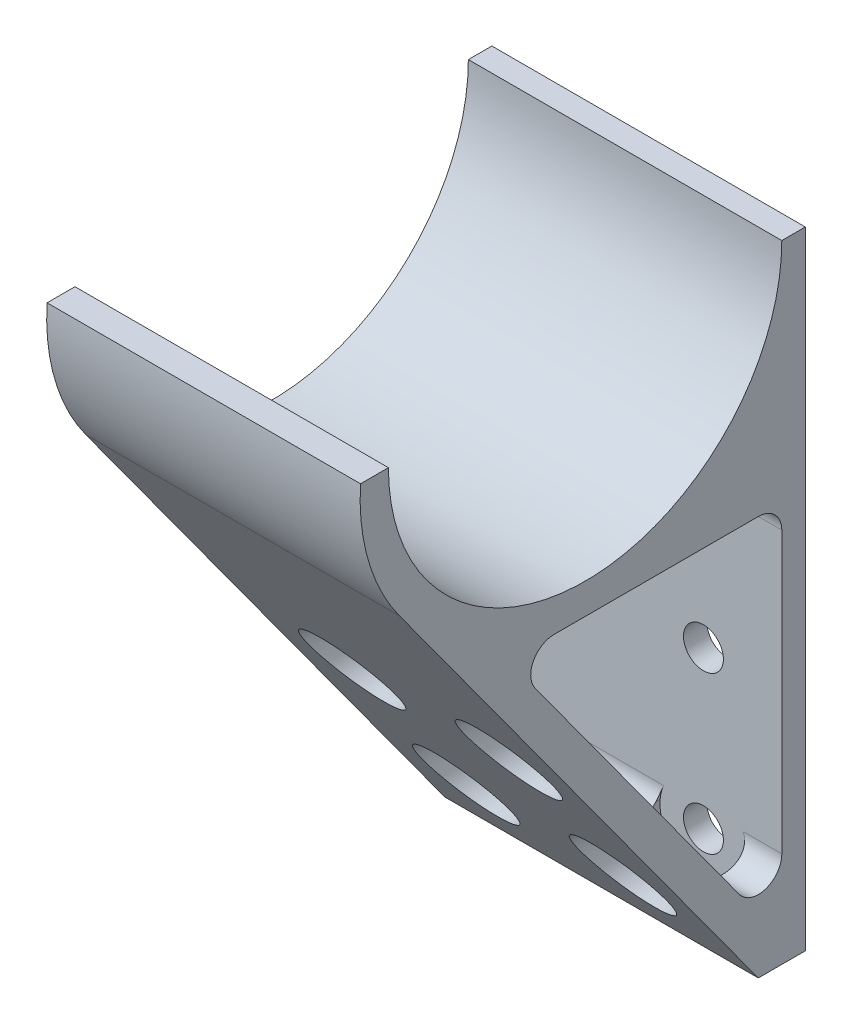
from build123d import *

# Parameters (mm, degrees)
EXTRUDE_1_DEPTH     = 40
SKETCH_2_R          = 2.55
CUT_EXTRUDE_1_DEPTH = 106.960776396
CUT_EXTRUDE_2_REACH = 106.383
SKETCH_3_R          = 5.55
SKETCH_3_R_2        = 2.55


with BuildPart() as part:
    # Эскиз1 → Бобышка-Вытянуть1 (new body)
    with BuildSketch(Plane(origin=(0, 0, 0), x_dir=(0, 0, -1), z_dir=(1, 0, 0))):
        with BuildLine():
            Line((0, 0), (0, -80))
            Line((0, -80), (-6, -80))
            Line((-6, -80), (-51.793990257, -17.080263038))
            ThreePointArc((-51.793990257, -17.080263038), (-55.770359862, -8.97429964), (-56.760361788, 0))
            Line((-56.760361788, 0), (-53.2, 0))
            ThreePointArc((-53.2, 0), (-28.1, -25.1), (-3, 0))
            Line((-3, 0), (0, 0))
        make_face()
        with BuildLine():
            Line((-3, -32), (-3, -67.780017305))
            ThreePointArc((-3, -67.780017305), (-5.071760776, -70.632800498), (-8.425581296, -69.545394143))
            Line((-8.425581296, -69.545394143), (-34.466849791, -33.765376837))
            ThreePointArc((-34.466849791, -33.765376837), (-34.714855086, -30.639141909), (-32.041268495, -29))
            Line((-32.041268495, -29), (-6, -29))
            ThreePointArc((-6, -29), (-3.878679656, -29.878679656), (-3, -32))
        make_face(mode=Mode.SUBTRACT)
    extrude(amount=EXTRUDE_1_DEPTH)

    # Эскиз2 → Вырез-Вытянуть1 (cut, through all)
    with BuildSketch(Plane(origin=(0, 0, 0), x_dir=(-1, 0, 0), z_dir=(0, 0, -1))):
        with Locations(Location((-30, -50, 0), (0, 0, 270))):
            Circle(SKETCH_2_R)
        with Locations(Location((-10, -50, 0), (0, 0, 270))):
            Circle(SKETCH_2_R)
        with Locations((-10, -70)):
            Circle(SKETCH_2_R)
        with Locations((-30, -70)):
            Circle(SKETCH_2_R)
    extrude(amount=-CUT_EXTRUDE_1_DEPTH, mode=Mode.SUBTRACT)

    # Вырез-Вытянуть2: up to this plane
    cut_extrude_2_end = Plane(origin=(40, -80, 6), z_dir=(0, 0.5884589457091373, -0.8085270986274306))
    # Эскиз3 → Вырез-Вытянуть2 (cut, up to the surface)
    with BuildSketch(Plane.XY.offset(3), mode=Mode.PRIVATE) as cut_extrude_2_sk1:
        with Locations(Location((10, -50, 0), (0, 0, 270))):
            Circle(SKETCH_3_R)
        with Locations(Location((10, -50, 0), (0, 0, 180))):
            Circle(SKETCH_3_R_2, mode=Mode.SUBTRACT)
    cut_extrude_2_tool1 = split(extrude(cut_extrude_2_sk1.sketch, amount=CUT_EXTRUDE_2_REACH, mode=Mode.PRIVATE), bisect_by=cut_extrude_2_end, keep=Keep.BOTH, mode=Mode.PRIVATE)
    add(cut_extrude_2_tool1.solids().sort_by_distance((10, -44.606978, 3))[0], mode=Mode.SUBTRACT)
    # Эскиз3 → Вырез-Вытянуть2 (cut, up to the surface)
    with BuildSketch(Plane.XY.offset(3), mode=Mode.PRIVATE) as cut_extrude_2_sk2:
        with Locations(Location((30, -50, 0), (0, 0, 270))):
            Circle(SKETCH_3_R)
        with Locations(Location((30, -50, 0), (0, 0, 180))):
            Circle(SKETCH_3_R_2, mode=Mode.SUBTRACT)
    cut_extrude_2_tool2 = split(extrude(cut_extrude_2_sk2.sketch, amount=CUT_EXTRUDE_2_REACH, mode=Mode.PRIVATE), bisect_by=cut_extrude_2_end, keep=Keep.BOTH, mode=Mode.PRIVATE)
    add(cut_extrude_2_tool2.solids().sort_by_distance((30, -44.606978, 3))[0], mode=Mode.SUBTRACT)
    # Эскиз3 → Вырез-Вытянуть2 (cut, up to the surface)
    with BuildSketch(Plane.XY.offset(3), mode=Mode.PRIVATE) as cut_extrude_2_sk3:
        with Locations(Location((10, -70, 0), (0, 0, 175.301583439))):
            Circle(SKETCH_3_R)
        with Locations(Location((10, -70, 0), (0, 0, 180))):
            Circle(SKETCH_3_R_2, mode=Mode.SUBTRACT)
    cut_extrude_2_tool3 = split(extrude(cut_extrude_2_sk3.sketch, amount=CUT_EXTRUDE_2_REACH, mode=Mode.PRIVATE), bisect_by=cut_extrude_2_end, keep=Keep.BOTH, mode=Mode.PRIVATE)
    add(cut_extrude_2_tool3.solids().sort_by_distance((15.3749, -70.441748, 3))[0], mode=Mode.SUBTRACT)
    # Эскиз3 → Вырез-Вытянуть2 (cut, up to the surface)
    with BuildSketch(Plane.XY.offset(3), mode=Mode.PRIVATE) as cut_extrude_2_sk4:
        with Locations(Location((30, -70, 0), (0, 0, 175.301583439))):
            Circle(SKETCH_3_R)
        with Locations(Location((30, -70, 0), (0, 0, 180))):
            Circle(SKETCH_3_R_2, mode=Mode.SUBTRACT)
    cut_extrude_2_tool4 = split(extrude(cut_extrude_2_sk4.sketch, amount=CUT_EXTRUDE_2_REACH, mode=Mode.PRIVATE), bisect_by=cut_extrude_2_end, keep=Keep.BOTH, mode=Mode.PRIVATE)
    add(cut_extrude_2_tool4.solids().sort_by_distance((35.3749, -70.441748, 3))[0], mode=Mode.SUBTRACT)


solid = part.part
